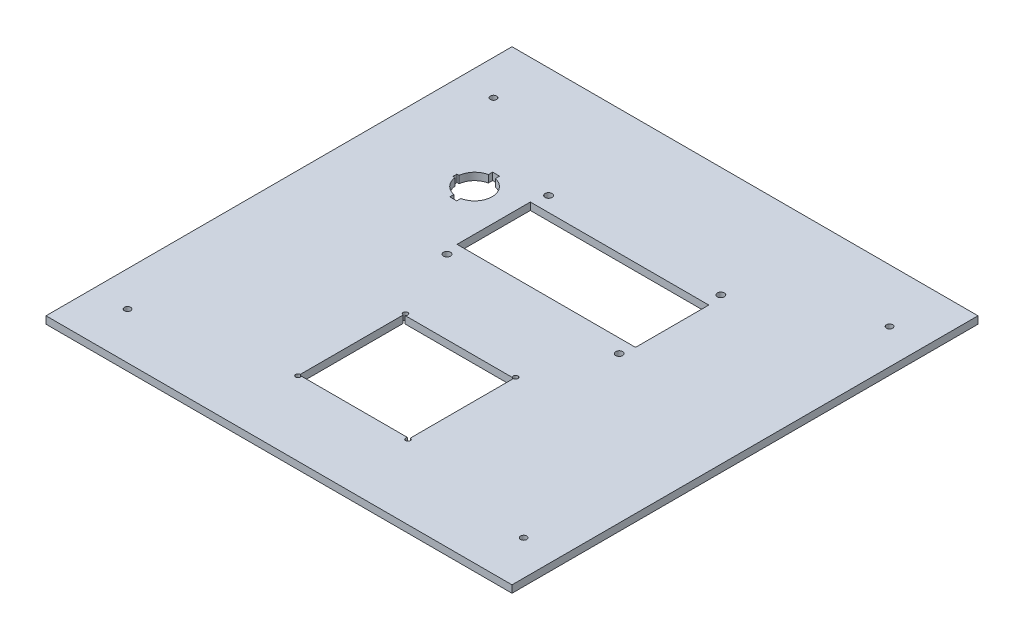
from build123d import *

# Parameters (mm, degrees)
SKETCH1_R           = 1.6891
SKETCH1_R_2         = 1.905
BOSS_EXTRUDE1_DEPTH = 4


with BuildPart() as part:
    # Sketch1 → Boss-Extrude1 (new body)
    with BuildSketch(Plane(origin=(0, 0, 0), x_dir=(1, 0, 0), z_dir=(0, 1, 0))):
        Polygon((28.575, 215.9), (28.575, 0), (282.575, 0), (282.575, 254), (28.575, 254), align=None)
        with Locations(Location((47.625, 25.4, 0), (0, 0, 270))):
            Circle(SKETCH1_R, mode=Mode.SUBTRACT)
        with BuildLine():
            Line((184.540258822, 41.0845), (155.163048801, 41.0845))
            Line((155.163048801, 41.0845), (126.602331606, 41.0845))
            ThreePointArc((126.602331606, 41.0845), (126.776599265, 40.735252505), (126.836576836, 40.349576836))
            ThreePointArc((126.836576836, 40.349576836), (124.678175908, 39.442028606), (125.5395, 41.61928816))
            Line((125.5395, 41.61928816), (125.5395, 97.69971184))
            ThreePointArc((125.5395, 97.69971184), (124.678175908, 99.876971394), (126.836576836, 98.969423164))
            ThreePointArc((126.836576836, 98.969423164), (126.712192056, 98.421275585), (126.363402398, 97.9805))
            Line((126.363402398, 97.9805), (184.786597602, 97.9805))
            ThreePointArc((184.786597602, 97.9805), (185.035275585, 100.115038384), (186.853423164, 98.969423164))
            ThreePointArc((186.853423164, 98.969423164), (186.490971394, 98.081022236), (185.6105, 97.69971184))
            Line((185.6105, 97.69971184), (185.6105, 41.589727831))
            ThreePointArc((185.6105, 41.589727831), (186.472493583, 41.199152325), (186.825084987, 40.320937393))
            ThreePointArc((186.825084987, 40.320937393), (185.152548795, 39.116418977), (184.540258822, 41.0845))
        make_face(mode=Mode.SUBTRACT)
        with Locations(Location((263.525, 25.4, 0), (0, 0, 270))):
            Circle(SKETCH1_R, mode=Mode.SUBTRACT)
        with BuildLine():
            Line((82.477295998, 189.534156397), (84.382295998, 189.534156397))
            Line((84.382295998, 189.534156397), (86.287295998, 189.534156397))
            Line((86.287295998, 189.534156397), (86.287295998, 187.197356397))
            ThreePointArc((86.287295998, 187.197356397), (93.970795998, 177.8), (86.287295998, 168.402643603))
            Line((86.287295998, 168.402643603), (86.287295998, 166.1795))
            Line((86.287295998, 166.1795), (84.382295998, 166.1795))
            Line((84.382295998, 166.1795), (82.477295998, 166.1795))
            Line((82.477295998, 166.1795), (82.477295998, 168.402643603))
            ThreePointArc((82.477295998, 168.402643603), (77.30886259, 171.326525503), (74.853325959, 176.7332))
            Line((74.853325959, 176.7332), (73.701595998, 176.7332))
            Line((73.701595998, 176.7332), (73.701595998, 177.8))
            Line((73.701595998, 177.8), (73.701595998, 178.8668))
            Line((73.701595998, 178.8668), (74.853325959, 178.8668))
            ThreePointArc((74.853325959, 178.8668), (77.30886259, 184.273474497), (82.477295998, 187.197356397))
            Line((82.477295998, 187.197356397), (82.477295998, 189.534156397))
        make_face(mode=Mode.SUBTRACT)
        with Locations(Location((108.760866591, 138.366268292, 0), (0, 0, 270))):
            Circle(SKETCH1_R_2, mode=Mode.SUBTRACT)
        Polygon((106.8705, 185.6994), (155.575, 185.6994), (204.1525, 185.6994), (204.1525, 145.7452), (106.8705, 145.7452), align=None, mode=Mode.SUBTRACT)
        with Locations(Location((47.625, 224.852960253, 0), (0, 0, 270))):
            Circle(SKETCH1_R, mode=Mode.SUBTRACT)
        with Locations(Location((108.760866591, 193.767535109, 0), (0, 0, 270))):
            Circle(SKETCH1_R_2, mode=Mode.SUBTRACT)
        with Locations(Location((202.643133409, 138.366268292, 0), (0, 0, 270))):
            Circle(SKETCH1_R_2, mode=Mode.SUBTRACT)
        with Locations(Location((202.643133409, 193.767535109, 0), (0, 0, 270))):
            Circle(SKETCH1_R_2, mode=Mode.SUBTRACT)
        with Locations(Location((263.525, 224.852960253, 0), (0, 0, 270))):
            Circle(SKETCH1_R, mode=Mode.SUBTRACT)
    extrude(amount=BOSS_EXTRUDE1_DEPTH)


solid = part.part
